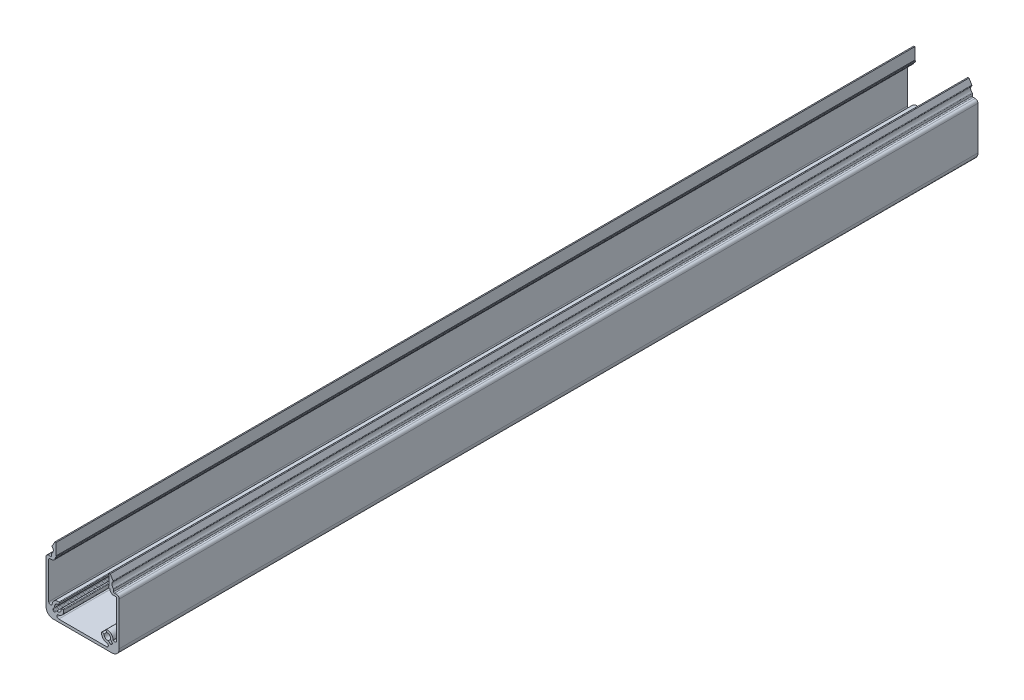
from build123d import *

# Parameters (mm, degrees)
BOSS_EXTRUDE1_DEPTH = 469


with BuildPart() as part:
    # Sketch1 → Boss-Extrude1 (new body)
    with BuildSketch(Plane.XY.offset(20)):
        with BuildLine():
            Line((4, 0), (36, 0))
            ThreePointArc((36, 0), (38.828427125, 1.171572875), (40, 4))
            Line((40, 4), (40, 27.499999994))
            ThreePointArc((40, 27.499999994), (39.56066017, 28.56066017), (38.499999994, 29))
            Line((38.499999994, 29), (37.408493132, 29))
            ThreePointArc((37.408493132, 29), (37.05493974, 29.14644661), (36.90849313, 29.500000002))
            Line((36.90849313, 29.500000002), (36.90849313, 30.572020267))
            ThreePointArc((36.90849313, 30.572020267), (36.86079319, 30.785150869), (36.726794508, 30.957616203))
            ThreePointArc((36.726794508, 30.957616203), (36.005111578, 32.357100716), (36.519951827, 33.845160752))
            ThreePointArc((36.519951827, 33.845160752), (36.647077826, 34.128030253), (36.582952488, 34.431450944))
            Line((36.582952488, 34.431450944), (35.099999998, 37.000000001))
            Line((35.099999998, 37.000000001), (34.500000002, 37.000000001))
            Line((34.500000002, 37.000000001), (34.500000002, 30.672689193))
            Line((34.500000002, 30.672689193), (34.158493132, 30.561067543))
            Line((34.158493132, 30.561067543), (34.158493132, 29.989862813))
            Line((34.158493132, 29.989862813), (34.908493132, 29.989862813))
            Line((34.908493132, 29.989862813), (34.908493132, 29.700000011))
            ThreePointArc((34.908493132, 29.700000011), (35.494279572, 28.285786443), (36.908493141, 27.700000003))
            Line((36.908493141, 27.700000003), (38.000000017, 27.700000003))
            ThreePointArc((38.000000017, 27.700000003), (38.353553409, 27.553553393), (38.500000019, 27.200000001))
            Line((38.500000019, 27.200000001), (38.500000019, 6.9547727))
            ThreePointArc((38.500000019, 6.9547727), (37.882683451, 6.030893167), (36.792893237, 6.247665919))
            Line((36.792893237, 6.247665919), (36.648161659, 6.392397496))
            ThreePointArc((36.648161659, 6.392397496), (35.587251229, 8.859212237), (33.009530056, 9.611581471))
            ThreePointArc((33.009530056, 9.611581471), (32.804700675, 9.478725012), (32.766463725, 9.237594653))
            Line((32.766463725, 9.237594653), (33.047066675, 8.190370192))
            ThreePointArc((33.047066675, 8.190370192), (34.786339421, 7.686520507), (35.148364083, 5.912296075))
            Line((35.148364083, 5.912296075), (36.146446608, 4.91421355))
            ThreePointArc((36.146446608, 4.91421355), (36.292893217, 4.560660161), (36.146446608, 4.207106773))
            Line((36.146446608, 4.207106773), (35.792893214, 3.853553379))
            ThreePointArc((35.792893214, 3.853553379), (35.439339826, 3.70710677), (35.085786437, 3.853553379))
            Line((35.085786437, 3.853553379), (34.087703906, 4.85163591))
            ThreePointArc((34.087703906, 4.85163591), (32.313479487, 5.213660585), (31.809629807, 6.952933321))
            Line((31.809629807, 6.952933321), (30.762405333, 7.233536272))
            ThreePointArc((30.762405333, 7.233536272), (30.521274984, 7.195299323), (30.38841853, 6.990469949))
            ThreePointArc((30.38841853, 6.990469949), (31.140787752, 4.412748784), (33.607602477, 3.351838341))
            Line((33.607602477, 3.351838341), (33.752334032, 3.207106785))
            ThreePointArc((33.752334032, 3.207106785), (33.969106782, 2.117316579), (33.045227255, 1.500000015))
            Line((33.045227255, 1.500000015), (6.954772716, 1.500000015))
            ThreePointArc((6.954772716, 1.500000015), (6.030893183, 2.117316583), (6.247665934, 3.207106797))
            Line((6.247665934, 3.207106797), (6.392397512, 3.351838375))
            ThreePointArc((6.392397512, 3.351838375), (8.859212224, 4.412748803), (9.611581449, 6.990469949))
            ThreePointArc((9.611581449, 6.990469949), (9.478724996, 7.195299323), (9.237594646, 7.233536272))
            Line((9.237594646, 7.233536272), (8.190370187, 6.952933328))
            ThreePointArc((8.190370187, 6.952933328), (7.686520502, 5.213660596), (5.912296085, 4.851635932))
            Line((5.912296085, 4.851635932), (4.914213553, 3.8535534))
            ThreePointArc((4.914213553, 3.8535534), (4.560660164, 3.707106791), (4.207106776, 3.8535534))
            Line((4.207106776, 3.8535534), (3.853553388, 4.207106787))
            ThreePointArc((3.853553388, 4.207106787), (3.70710678, 4.560660175), (3.853553388, 4.914213564))
            Line((3.853553388, 4.914213564), (4.85163592, 5.912296095))
            ThreePointArc((4.85163592, 5.912296095), (5.213660585, 7.686520517), (6.952933322, 8.190370198))
            Line((6.952933322, 8.190370198), (7.233536268, 9.237594644))
            ThreePointArc((7.233536268, 9.237594644), (7.195299318, 9.478725003), (6.990469936, 9.611581462))
            ThreePointArc((6.990469936, 9.611581462), (4.412748785, 8.859212233), (3.351838362, 6.392397513))
            Line((3.351838362, 6.392397513), (3.207106785, 6.247665935))
            ThreePointArc((3.207106785, 6.247665935), (2.11731657, 6.030893183), (1.500000002, 6.954772717))
            Line((1.500000002, 6.954772717), (1.500000002, 27.200000001))
            ThreePointArc((1.500000002, 27.200000001), (1.646446612, 27.553553393), (2.000000004, 27.700000003))
            Line((2.000000004, 27.700000003), (3.091506864, 27.700000003))
            ThreePointArc((3.091506864, 27.700000003), (4.505720432, 28.285786443), (5.091506872, 29.700000011))
            Line((5.091506872, 29.700000011), (5.091506872, 29.989862813))
            Line((5.091506872, 29.989862813), (5.841506868, 29.989862813))
            Line((5.841506868, 29.989862813), (5.841506868, 30.561067541))
            Line((5.841506868, 30.561067541), (5.499999998, 30.672689191))
            Line((5.499999998, 30.672689191), (5.499999998, 37.000000001))
            Line((5.499999998, 37.000000001), (4.899999998, 37.000000001))
            Line((4.899999998, 37.000000001), (3.417047508, 34.431450944))
            ThreePointArc((3.417047508, 34.431450944), (3.35292217, 34.128030253), (3.480048169, 33.845160751))
            ThreePointArc((3.480048169, 33.845160751), (3.99488842, 32.357100716), (3.273205491, 30.957616203))
            ThreePointArc((3.273205491, 30.957616203), (3.13920681, 30.785150869), (3.09150687, 30.572020267))
            Line((3.09150687, 30.572020267), (3.09150687, 29.500000002))
            ThreePointArc((3.09150687, 29.500000002), (2.94506026, 29.14644661), (2.591506868, 29))
            Line((2.591506868, 29), (1.500000006, 29))
            ThreePointArc((1.500000006, 29), (0.43933983, 28.56066017), (0, 27.499999994))
            Line((0, 27.499999994), (0, 4))
            ThreePointArc((0, 4), (1.171572875, 1.171572875), (4, 0))
        make_face()
    extrude(amount=-BOSS_EXTRUDE1_DEPTH)


solid = part.part
